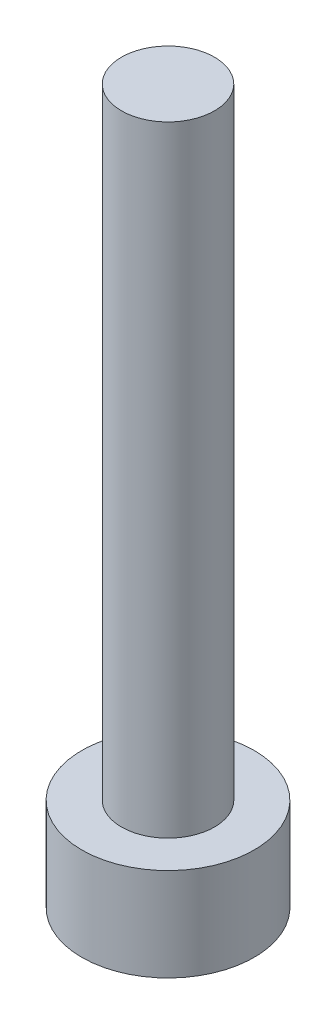
from build123d import *

# Parameters (mm, degrees)
SKETCH1_R           = 2.78
BOSS_EXTRUDE1_DEPTH = 3
SKETCH2_R           = 1.5
BOSS_EXTRUDE2_DEPTH = 20


with BuildPart() as part:
    # Sketch1 → Boss-Extrude1 (new body)
    with BuildSketch(Plane(origin=(0, 0, 0), x_dir=(1, 0, 0), z_dir=(0, 1, 0))):
        with Locations(Location((0, 0, 0), (0, 0, 270))):
            Circle(SKETCH1_R)
    extrude(amount=BOSS_EXTRUDE1_DEPTH)

    # Sketch2 → Boss-Extrude2 (add)
    with BuildSketch(Plane(origin=(0, 3, 0), x_dir=(1, 0, 0), z_dir=(0, 1, 0))):
        with Locations(Location((0, 0, 0), (0, 0, 270))):
            Circle(SKETCH2_R)
    extrude(amount=BOSS_EXTRUDE2_DEPTH)


solid = part.part
